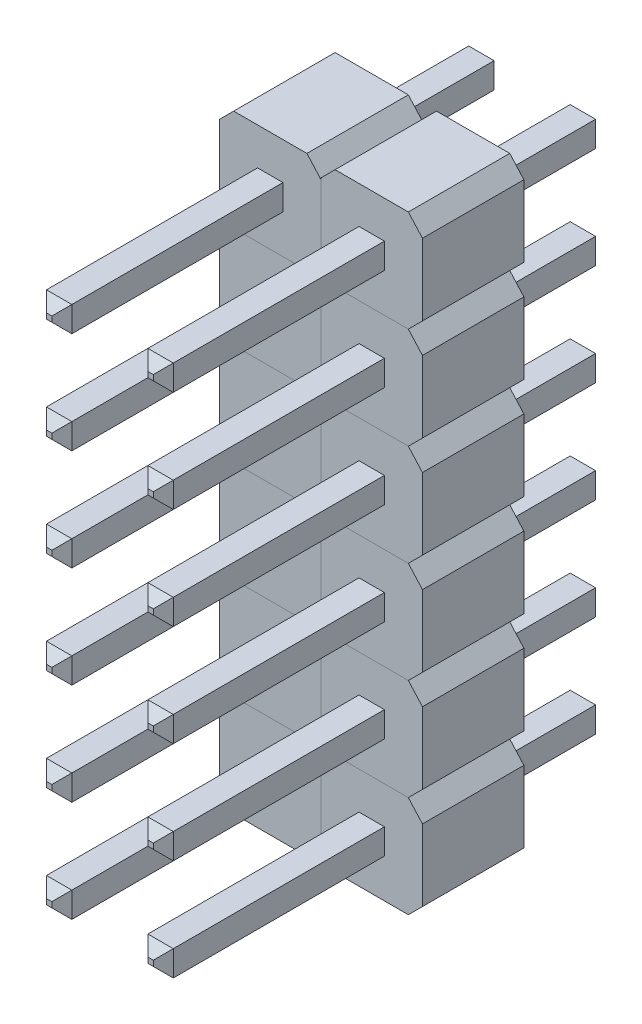
from build123d import *

# Parameters (mm, degrees)
PIN_DRAWING_W            = 0.636
PIN_DRAWING_H            = 0.636
BOSS_EXTRUDE1_DEPTH      = 2.54
BOSS_EXTRUDE2_DEPTH      = 5.5372
BOSS_EXTRUDE2_DEPTH_BACK = 5.5372
SKETCH1_W                = 0.636
SKETCH1_H                = 0.636
CHAMFER1_SIZE            = 0.25
LPATTERN2_COUNT          = 6
LPATTERN2_PITCH          = 2.54
LPATTERN2_2_COUNT        = 2
LPATTERN2_2_PITCH        = 2.54


with BuildPart() as part:
    # pin_drawing → Boss-Extrude1 (new body)
    with BuildSketch(Plane.XY):
        Polygon((-0.916946609, 1.25), (0.916946609, 1.25), (1.2705, 0.856446609), (1.2705, -0.936446609), (0.916946609, -1.29), (-0.916946609, -1.29), (-1.2705, -0.896446609), (-1.2705, 0.896446609), align=None)
        Rectangle(PIN_DRAWING_W, PIN_DRAWING_H, mode=Mode.SUBTRACT)
    extrude(amount=BOSS_EXTRUDE1_DEPTH)


with BuildPart() as body_2:
    # Sketch1 → Boss-Extrude2 (new, two sides: drawn at the far end of the back side and taken through both)
    with BuildSketch(Plane.XY.offset(2.54).offset(-BOSS_EXTRUDE2_DEPTH_BACK)):
        Rectangle(SKETCH1_W, SKETCH1_H)
    extrude(amount=BOSS_EXTRUDE2_DEPTH + BOSS_EXTRUDE2_DEPTH_BACK)

    # Chamfer1
    chamfer1_edges = [body_2.edges().sort_by_distance(p)[0] for p in [
        (0, 0.318, -2.9972),
        (0, -0.318, 8.0772),
        (0.318, 0, 8.0772),
        (-0.318, 0, -2.9972),
        (0, 0.318, 8.0772),
        (-0.318, 0, 8.0772),
        (0, -0.318, -2.9972),
        (0.318, 0, -2.9972),
    ]]
    chamfer(chamfer1_edges, length=CHAMFER1_SIZE)


with BuildPart() as lpattern2_1:
    # LPattern2: pattern copy
    add(body_2.part.moved(Location(Vector(0, -1, 0) * (1 * LPATTERN2_PITCH))))


with BuildPart() as lpattern2_2:
    # LPattern2: pattern copy
    add(body_2.part.moved(Location(Vector(0, -1, 0) * (2 * LPATTERN2_PITCH))))


with BuildPart() as lpattern2_3:
    # LPattern2: pattern copy
    add(body_2.part.moved(Location(Vector(0, -1, 0) * (3 * LPATTERN2_PITCH))))


with BuildPart() as lpattern2_4:
    # LPattern2: pattern copy
    add(body_2.part.moved(Location(Vector(0, -1, 0) * (4 * LPATTERN2_PITCH))))


with BuildPart() as lpattern2_5:
    # LPattern2: pattern copy
    add(body_2.part.moved(Location(Vector(0, -1, 0) * (5 * LPATTERN2_PITCH))))


with BuildPart() as lpattern2_6:
    # LPattern2: pattern copy
    add(part.part.moved(Location(Vector(0, -1, 0) * (1 * LPATTERN2_PITCH))))


with BuildPart() as lpattern2_7:
    # LPattern2: pattern copy
    add(part.part.moved(Location(Vector(0, -1, 0) * (2 * LPATTERN2_PITCH))))


with BuildPart() as lpattern2_8:
    # LPattern2: pattern copy
    add(part.part.moved(Location(Vector(0, -1, 0) * (3 * LPATTERN2_PITCH))))


with BuildPart() as lpattern2_9:
    # LPattern2: pattern copy
    add(part.part.moved(Location(Vector(0, -1, 0) * (4 * LPATTERN2_PITCH))))


with BuildPart() as lpattern2_10:
    # LPattern2: pattern copy
    add(part.part.moved(Location(Vector(0, -1, 0) * (5 * LPATTERN2_PITCH))))


with BuildPart() as lpattern2_2_1:
    # LPattern2 2: pattern copy
    add(body_2.part.moved(Location(Vector(1, 0, 0) * (1 * LPATTERN2_2_PITCH))))


with BuildPart() as lpattern2_2_2:
    # LPattern2 2: pattern copy
    add(part.part.moved(Location(Vector(1, 0, 0) * (1 * LPATTERN2_2_PITCH))))


with BuildPart() as lpattern2_2_3:
    # LPattern2 2: pattern copy
    add(lpattern2_1.part.moved(Location(Vector(1, 0, 0) * (1 * LPATTERN2_2_PITCH))))


with BuildPart() as lpattern2_2_4:
    # LPattern2 2: pattern copy
    add(lpattern2_2.part.moved(Location(Vector(1, 0, 0) * (1 * LPATTERN2_2_PITCH))))


with BuildPart() as lpattern2_2_5:
    # LPattern2 2: pattern copy
    add(lpattern2_3.part.moved(Location(Vector(1, 0, 0) * (1 * LPATTERN2_2_PITCH))))


with BuildPart() as lpattern2_2_6:
    # LPattern2 2: pattern copy
    add(lpattern2_4.part.moved(Location(Vector(1, 0, 0) * (1 * LPATTERN2_2_PITCH))))


with BuildPart() as lpattern2_2_7:
    # LPattern2 2: pattern copy
    add(lpattern2_5.part.moved(Location(Vector(1, 0, 0) * (1 * LPATTERN2_2_PITCH))))


with BuildPart() as lpattern2_2_8:
    # LPattern2 2: pattern copy
    add(lpattern2_6.part.moved(Location(Vector(1, 0, 0) * (1 * LPATTERN2_2_PITCH))))


with BuildPart() as lpattern2_2_9:
    # LPattern2 2: pattern copy
    add(lpattern2_7.part.moved(Location(Vector(1, 0, 0) * (1 * LPATTERN2_2_PITCH))))


with BuildPart() as lpattern2_2_10:
    # LPattern2 2: pattern copy
    add(lpattern2_8.part.moved(Location(Vector(1, 0, 0) * (1 * LPATTERN2_2_PITCH))))


with BuildPart() as lpattern2_2_11:
    # LPattern2 2: pattern copy
    add(lpattern2_9.part.moved(Location(Vector(1, 0, 0) * (1 * LPATTERN2_2_PITCH))))


with BuildPart() as lpattern2_2_12:
    # LPattern2 2: pattern copy
    add(lpattern2_10.part.moved(Location(Vector(1, 0, 0) * (1 * LPATTERN2_2_PITCH))))


solid = Compound([part.part, body_2.part, lpattern2_1.part, lpattern2_2.part, lpattern2_3.part, lpattern2_4.part, lpattern2_5.part, lpattern2_6.part, lpattern2_7.part, lpattern2_8.part, lpattern2_9.part, lpattern2_10.part, lpattern2_2_1.part, lpattern2_2_2.part, lpattern2_2_3.part, lpattern2_2_4.part, lpattern2_2_5.part, lpattern2_2_6.part, lpattern2_2_7.part, lpattern2_2_8.part, lpattern2_2_9.part, lpattern2_2_10.part, lpattern2_2_11.part, lpattern2_2_12.part])
